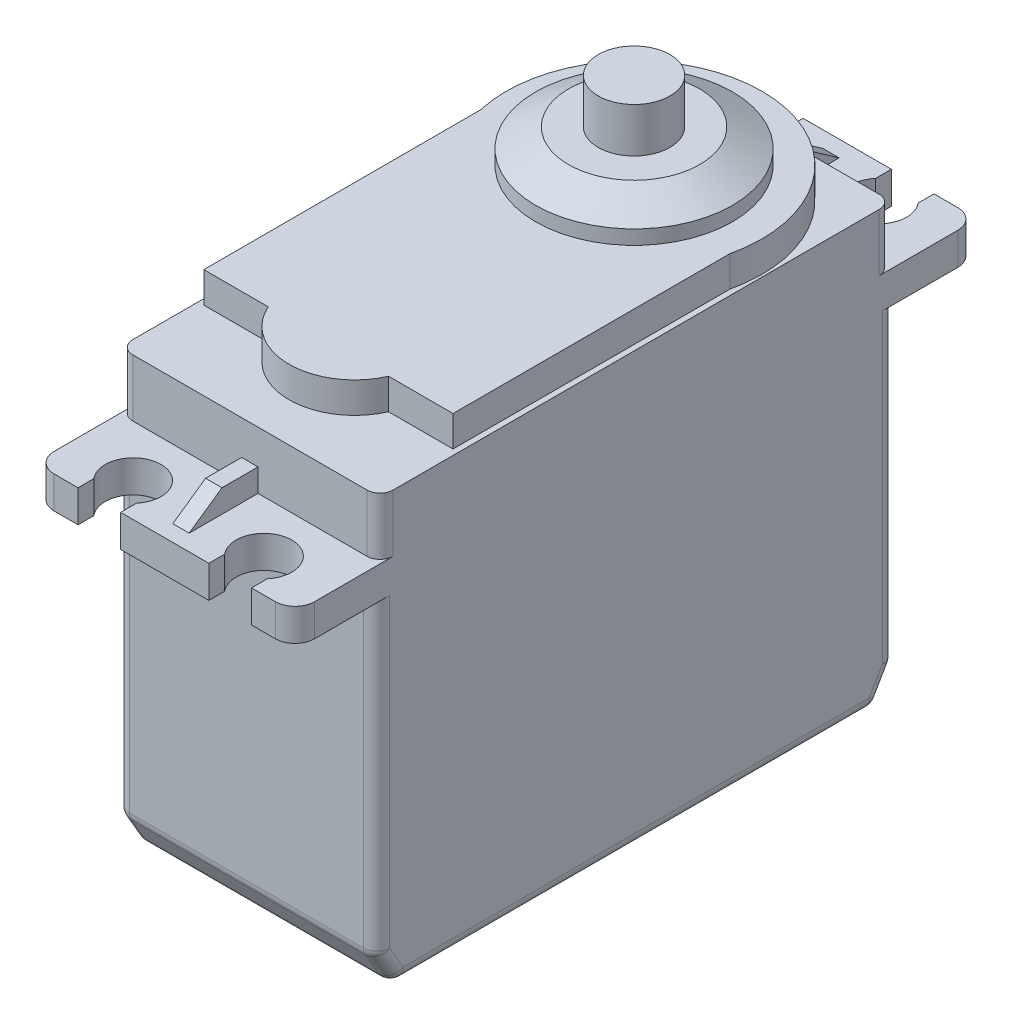
from build123d import *
from OCP.BRepFilletAPI import BRepFilletAPI_MakeChamfer

# Parameters (mm, degrees)
SKETCH1_W          = 20.1676
SKETCH1_H          = 40.2082
EXTRUDE1_DEPTH     = 26.4668
SKETCH2_W          = 20.1676
SKETCH2_H          = 40.2082
EXTRUDE2_DEPTH     = 2.4892
SKETCH3_W          = 20.1676
SKETCH3_H          = 40.2082
EXTRUDE3_DEPTH     = 4.445
SKETCH11_W         = 20.1676
SKETCH11_H         = 0.2667
CUT_EXTRUDE2_DEPTH = 4.445
EXTRUDE4_DEPTH     = 2.38125
SKETCH5_R          = 7.62
EXTRUDE5_DEPTH     = 2.57175
CHAMFER1_SIZE      = 2.54
CHAMFER1_SIZE2     = 1.466469684
EXTRUDE6_DEPTH     = 0.635
SKETCH8_R          = 2.778125
EXTRUDE7_DEPTH     = 3.4544
CHAMFER2_SIZE      = 2.54
CHAMFER2_SIZE2     = 1.466469684
FILLET1_R          = 1.016
FILLET2_R          = 1.524
SKETCH9_W          = 6.35
SKETCH9_H          = 2.54
EXTRUDE8_DEPTH     = 2.38125
SKETCH10_W         = 5.08
SKETCH10_H         = 1.27
CUT_EXTRUDE1_DEPTH = 2.38125


with BuildPart() as part:
    # Sketch1 → Extrude1 (new body)
    with BuildSketch(Plane(origin=(0, 0, 0), x_dir=(1, 0, 0), z_dir=(0, 1, 0))):
        with Locations((0, -9.9187)):
            Rectangle(SKETCH1_W, SKETCH1_H)
    extrude(amount=EXTRUDE1_DEPTH)

    # Sketch2 → Extrude2 (add)
    with BuildSketch(Plane(origin=(0, 26.4668, 0), x_dir=(-1, 0, 0), z_dir=(0, 1, 0))):
        with Locations((0, 9.9187)):
            Rectangle(SKETCH2_W, SKETCH2_H)
        with BuildLine():
            ThreePointArc((6.7183, -15.285015296), (5.0673, -11.7348), (3.4163, -15.285015296))
            Line((3.4163, -15.285015296), (3.4163, -16.51))
            Line((3.4163, -16.51), (-3.4163, -16.51))
            Line((-3.4163, -16.51), (-3.4163, -15.285015296))
            ThreePointArc((-3.4163, -15.285015296), (-5.0673, -11.7348), (-6.7183, -15.285015296))
            Line((-6.7183, -15.285015296), (-6.7183, -16.51))
            Line((-6.7183, -16.51), (-10.0838, -16.51))
            Line((-10.0838, -16.51), (-10.0838, -10.1854))
            Line((-10.0838, -10.1854), (10.0838, -10.1854))
            Line((10.0838, -10.1854), (10.0838, -16.51))
            Line((10.0838, -16.51), (6.7183, -16.51))
            Line((6.7183, -16.51), (6.7183, -15.285015296))
        make_face()
        with BuildLine():
            ThreePointArc((-6.7183, 35.122415296), (-5.0673, 31.5722), (-3.4163, 35.122415296))
            Line((-3.4163, 35.122415296), (-3.4163, 36.3474))
            Line((-3.4163, 36.3474), (3.4163, 36.3474))
            Line((3.4163, 36.3474), (3.4163, 35.122415296))
            ThreePointArc((3.4163, 35.122415296), (5.0673, 31.5722), (6.7183, 35.122415296))
            Line((6.7183, 35.122415296), (6.7183, 36.3474))
            Line((6.7183, 36.3474), (10.0838, 36.3474))
            Line((10.0838, 36.3474), (10.0838, 30.0228))
            Line((10.0838, 30.0228), (-10.0838, 30.0228))
            Line((-10.0838, 30.0228), (-10.0838, 36.3474))
            Line((-10.0838, 36.3474), (-6.7183, 36.3474))
            Line((-6.7183, 36.3474), (-6.7183, 35.122415296))
        make_face()
    extrude(amount=EXTRUDE2_DEPTH)

    # Sketch3 → Extrude3 (add)
    with BuildSketch(Plane(origin=(0, 28.956, 0), x_dir=(-1, 0, 0), z_dir=(0, 1, 0))):
        with Locations((0, 9.9187)):
            Rectangle(SKETCH3_W, SKETCH3_H)
    extrude(amount=EXTRUDE3_DEPTH)

    # Sketch11 → Cut-Extrude2 (cut)
    with BuildSketch(Plane(origin=(0, 33.401, 0), x_dir=(1, 0, 0), z_dir=(0, 1, 0))):
        with Locations((0, 10.05205)):
            Rectangle(SKETCH11_W, SKETCH11_H)
        with Locations((0, -29.88945)):
            Rectangle(SKETCH11_W, SKETCH11_H)
    extrude(amount=-CUT_EXTRUDE2_DEPTH, mode=Mode.SUBTRACT)

    # Sketch4 → Extrude4 (add)
    with BuildSketch(Plane(origin=(0, 33.401, 0), x_dir=(-1, 0, 0), z_dir=(0, 1, 0))):
        with BuildLine():
            Line((9.652, 2.228840954), (9.652, 23.6728))
            Line((9.652, 23.6728), (4.655896906, 23.6728))
            ThreePointArc((4.655896906, 23.6728), (0, 26.7208), (-4.655896906, 23.6728))
            Line((-4.655896906, 23.6728), (-9.652, 23.6728))
            Line((-9.652, 23.6728), (-9.652, 2.228840954))
            ThreePointArc((-9.652, 2.228840954), (0, -9.906), (9.652, 2.228840954))
        make_face()
    extrude(amount=EXTRUDE4_DEPTH)

    # Sketch5 → Extrude5 (add)
    with BuildSketch(Plane(origin=(0, 35.78225, 0), x_dir=(-1, 0, 0), z_dir=(0, 1, 0))):
        with Locations(Location((0, 0, 0), (0, 0, 270))):
            Circle(SKETCH5_R)
    extrude(amount=EXTRUDE5_DEPTH)

    # Chamfer1
    chamfer1_edges = [part.edges().sort_by_distance(p)[0] for p in [
        (0, 38.354, 7.62),
    ]]
    chamfer1_side = [part.faces().sort_by_distance(p)[0] for p in [
        (0, 38.354, 0),
    ]]
    chamfer(chamfer1_edges, length=CHAMFER1_SIZE, length2=CHAMFER1_SIZE2, reference=chamfer1_side[0])

    # Sketch7 → Extrude6 (add, symmetric)
    with BuildSketch(Plane(origin=(0, 0, 0), x_dir=(0, 0, -1), z_dir=(1, 0, 0))):
        Polygon((15.2527, 28.956), (12.7127, 30.734), (9.9187, 30.734), (9.9187, 28.956), align=None)
    extrude6 = extrude(amount=EXTRUDE6_DEPTH, both=True)

    # Mirror1: Extrude6 across plane
    add(extrude6.mirror(Plane(origin=(0, 0, 9.9187), x_dir=(1, 0, 0), z_dir=(0, 0, -1))))

    # Sketch8 → Extrude7 (add)
    with BuildSketch(Plane(origin=(0, 38.354, 0), x_dir=(-1, 0, 0), z_dir=(0, 1, 0))):
        with Locations(Location((0, 0, 0), (0, 0, 270))):
            Circle(SKETCH8_R)
    extrude(amount=EXTRUDE7_DEPTH)

    # Chamfer2: one chamfer whose edges measure the first distance from different faces: ONE call of the kernel's chamfer builder (chamfer() names one face for all edges)
    chamfer2_edges_1 = [part.edges().sort_by_distance(p)[0] for p in [
        (0, 0, -10.1854),
    ]]
    chamfer2_side_1 = [part.faces().sort_by_distance(p)[0] for p in [
        (0, 13.2334, -10.1854),
    ]]
    chamfer2_edges_2 = [part.edges().sort_by_distance(p)[0] for p in [
        (0, 0, 30.0228),
    ]]
    chamfer2_side_2 = [part.faces().sort_by_distance(p)[0] for p in [
        (0, 13.2334, 30.0228),
    ]]
    chamfer2 = BRepFilletAPI_MakeChamfer(part.part.solid().wrapped)
    for e in chamfer2_edges_1:
        chamfer2.Add(CHAMFER2_SIZE, CHAMFER2_SIZE2, e.wrapped, chamfer2_side_1[0].wrapped)  # the first distance lies on this face
    for e in chamfer2_edges_2:
        chamfer2.Add(CHAMFER2_SIZE, CHAMFER2_SIZE2, e.wrapped, chamfer2_side_2[0].wrapped)  # the first distance lies on this face
    add(Compound.cast(chamfer2.Shape()), mode=Mode.REPLACE)

    # Fillet1
    fillet1_edges = [part.edges().sort_by_distance(p)[0] for p in [
        (10.0838, 0, 9.9187),
        (10.0838, 1.27, -9.452165158),
        (10.0838, 14.5034, -10.1854),
        (0, 0, -8.718930316),
        (0, 2.54, -10.1854),
        (-10.0838, 14.5034, -10.1854),
        (-10.0838, 1.27, -9.452165158),
        (10.0838, 14.5034, 30.0228),
        (10.0838, 1.27, 29.289565158),
        (0, 2.54, 30.0228),
        (-10.0838, 0, 9.9187),
        (0, 0, 28.556330316),
        (-10.0838, 1.27, 29.289565158),
        (-10.0838, 14.5034, 30.0228),
        (10.0838, 31.1785, 29.7561),
        (-10.0838, 31.1785, 29.7561),
        (10.0838, 31.1785, -9.9187),
        (-10.0838, 31.1785, -9.9187),
    ]]
    fillet(fillet1_edges, radius=FILLET1_R)

    # Fillet2
    fillet2_edges = [part.edges().sort_by_distance(p)[0] for p in [
        (-10.0838, 27.7114, 36.3474),
        (10.0838, 27.7114, 36.3474),
        (-10.0838, 27.7114, -16.51),
        (10.0838, 27.7114, -16.51),
    ]]
    fillet(fillet2_edges, radius=FILLET2_R)

    # Sketch9 → Extrude8 (add)
    with BuildSketch(Plane(origin=(0, 0, -10.1854), x_dir=(-1, 0, 0), z_dir=(0, 0, -1))):
        with Locations((0, 4.318)):
            Rectangle(SKETCH9_W, SKETCH9_H)
    extrude(amount=EXTRUDE8_DEPTH)

    # Sketch10 → Cut-Extrude1 (cut)
    with BuildSketch(Plane(origin=(0, 0, -12.56665), x_dir=(-1, 0, 0), z_dir=(0, 0, -1))):
        with Locations((0, 4.318)):
            Rectangle(SKETCH10_W, SKETCH10_H)
    extrude(amount=-CUT_EXTRUDE1_DEPTH, mode=Mode.SUBTRACT)


solid = part.part
